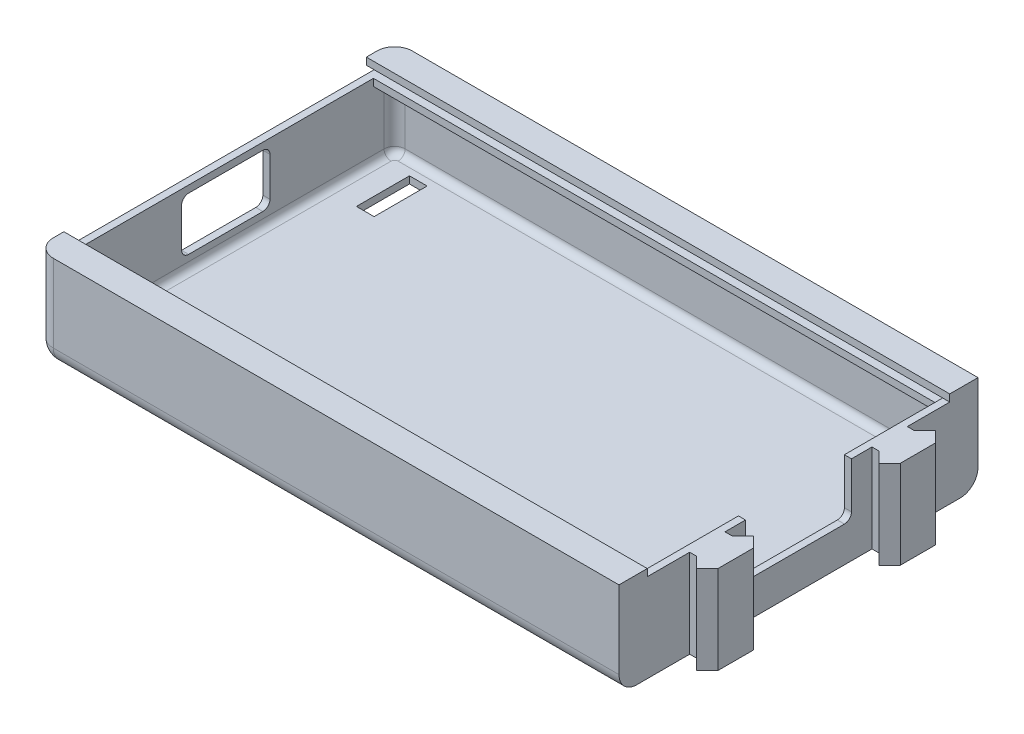
from build123d import *

# Parameters (mm, degrees)
SKETCH1_W           = 165.1
SKETCH1_H           = 101.6
BOSS_EXTRUDE1_DEPTH = 25
SHELL1_T            = -2
SKETCH2_W           = 5
SKETCH2_H           = 15
CUT_EXTRUDE1_DEPTH  = 25
CUT_EXTRUDE2_REACH  = 176.538
FILLET1_R           = 5
FILLET2_R           = 3
FILLET3_R           = 2
FILLET4_R           = 5
CUT_EXTRUDE3_REACH  = 176.538
SKETCH4_W           = 91.6
SKETCH4_H           = 4.4
BOSS_EXTRUDE4_START = -2.2
BOSS_EXTRUDE4_DEPTH = 2.2
BOSS_EXTRUDE2_START = 2
BOSS_EXTRUDE2_DEPTH = 2
LPATTERN1_COUNT     = 2
LPATTERN1_PITCH     = 4.2
BOSS_EXTRUDE3_DEPTH = 25
CUT_EXTRUDE4_REACH  = 182.513


with BuildPart() as part:
    # Sketch1 → Boss-Extrude1 (new body)
    with BuildSketch(Plane(origin=(0, 0, 0), x_dir=(1, 0, 0), z_dir=(0, 1, 0))):
        Rectangle(SKETCH1_W, SKETCH1_H)
    extrude(amount=BOSS_EXTRUDE1_DEPTH)

    # Shell1
    shell1_openings = [part.faces().sort_by_distance(p)[0] for p in [
        (0, 25, 0),
    ]]
    offset(amount=SHELL1_T, openings=shell1_openings, kind=Kind.INTERSECTION)

    # Sketch2 → Cut-Extrude1 (cut)
    with BuildSketch(Plane(origin=(0, 2, 0), x_dir=(1, 0, 0), z_dir=(0, 1, 0))):
        with Locations((-69.85, 37.3)):
            Rectangle(SKETCH2_W, SKETCH2_H)
    extrude(amount=-CUT_EXTRUDE1_DEPTH, mode=Mode.SUBTRACT)

    # Sketch3 → Cut-Extrude2 (cut, up to next)
    with BuildSketch(Plane(origin=(82.55, 0, 0), x_dir=(0, 0, -1), z_dir=(1, 0, 0)), mode=Mode.PRIVATE) as cut_extrude2_sk1:
        with BuildLine():
            Line((-15, 40), (15, 40))
            Line((15, 40), (15, 12))
            ThreePointArc((15, 12), (14.414213562, 10.585786438), (13, 10))
            Line((13, 10), (-13, 10))
            ThreePointArc((-13, 10), (-14.414213562, 10.585786438), (-15, 12))
            Line((-15, 12), (-15, 40))
        make_face()
    cut_extrude2_tool1 = extrude(cut_extrude2_sk1.sketch, amount=-CUT_EXTRUDE2_REACH, mode=Mode.PRIVATE) & part.part
    add(cut_extrude2_tool1.solids().sort_by_distance((82.55, 25.027814, 0))[0], mode=Mode.SUBTRACT)

    # Fillet1
    fillet1_edges = [part.edges().sort_by_distance(p)[0] for p in [
        (-82.55, 12.5, -50.8),
        (-82.55, 12.5, 50.8),
    ]]
    fillet(fillet1_edges, radius=FILLET1_R)

    # Fillet2
    fillet2_edges = [part.edges().sort_by_distance(p)[0] for p in [
        (-80.55, 13.5, -48.8),
        (-80.55, 13.5, 48.8),
        (80.55, 13.5, 48.8),
        (80.55, 13.5, -48.8),
    ]]
    fillet(fillet2_edges, radius=FILLET2_R)

    # Fillet3
    fillet3_edges = [part.edges().sort_by_distance(p)[0] for p in [
        (80.55, 2, 0),
        (-80.55, 2, 0),
        (0, 2, 48.8),
        (0, 2, -48.8),
        (-79.671320344, 2, -47.921320344),
        (-79.671320344, 2, 47.921320344),
        (79.671320344, 2, 47.921320344),
        (79.671320344, 2, -47.921320344),
    ]]
    fillet(fillet3_edges, radius=FILLET3_R)

    # Fillet4
    fillet4_edges = [part.edges().sort_by_distance(p)[0] for p in [
        (2.5, 0, -50.8),
        (2.5, 0, 50.8),
        (-82.55, 0, 0),
        (-81.085533906, 0, -49.335533906),
        (-81.085533906, 0, 49.335533906),
    ]]
    fillet(fillet4_edges, radius=FILLET4_R)

    # Sketch4 → Cut-Extrude3 (cut, up to next)
    with BuildSketch(Plane.ZY.offset(82.55), mode=Mode.PRIVATE) as cut_extrude3_sk1:
        with Locations((0, 25)):
            Rectangle(SKETCH4_W, SKETCH4_H)
    cut_extrude3_tool1 = extrude(cut_extrude3_sk1.sketch, amount=-CUT_EXTRUDE3_REACH, mode=Mode.PRIVATE) & part.part
    add(cut_extrude3_tool1.solids().sort_by_distance((-82.55, 25, 0))[0], mode=Mode.SUBTRACT)

    # Sketch8 → Boss-Extrude4 (add)
    with BuildSketch(Plane(origin=(0, 25, 0), x_dir=(1, 0, 0), z_dir=(0, 1, 0)).offset(BOSS_EXTRUDE4_START)):
        with BuildLine():
            Line((-77.55, -48.8), (77.55, -48.8))
            ThreePointArc((77.55, -48.8), (79.671320344, -47.921320344), (80.55, -45.8))
            Line((80.55, -45.8), (-80.55, -45.8))
            ThreePointArc((-80.55, -45.8), (-79.671320344, -47.921320344), (-77.55, -48.8))
        make_face()
        with BuildLine():
            Line((77.55, 48.8), (-77.55, 48.8))
            ThreePointArc((-77.55, 48.8), (-79.671320344, 47.921320344), (-80.55, 45.8))
            Line((-80.55, 45.8), (80.55, 45.8))
            ThreePointArc((80.55, 45.8), (79.671320344, 47.921320344), (77.55, 48.8))
        make_face()
    extrude(amount=BOSS_EXTRUDE4_DEPTH)

    # Sketch5 → Boss-Extrude2 (add)
    with BuildSketch(Plane(origin=(0, 25, 0), x_dir=(1, 0, 0), z_dir=(0, 1, 0)).offset(BOSS_EXTRUDE2_START)):
        with BuildLine():
            Line((-77.55, -50.8), (82.55, -50.8))
            Line((82.55, -50.8), (82.55, -42.8))
            Line((82.55, -42.8), (-82.55, -42.8))
            Line((-82.55, -42.8), (-82.55, -45.8))
            ThreePointArc((-82.55, -45.8), (-81.085533906, -49.335533906), (-77.55, -50.8))
        make_face()
        with BuildLine():
            Line((82.55, 50.8), (-77.55, 50.8))
            ThreePointArc((-77.55, 50.8), (-81.085533906, 49.335533906), (-82.55, 45.8))
            Line((-82.55, 45.8), (-82.55, 42.8))
            Line((-82.55, 42.8), (82.55, 42.8))
            Line((82.55, 42.8), (82.55, 50.8))
        make_face()
    boss_extrude2 = extrude(amount=-BOSS_EXTRUDE2_DEPTH)

    # LPattern1: Boss-Extrude2 ×2
    with Locations(*[(0, -i * LPATTERN1_PITCH, 0) for i in range(1, LPATTERN1_COUNT)]):
        add(boss_extrude2)

    # Sketch6 → Boss-Extrude3 (add)
    with BuildSketch(Plane.XZ):
        Polygon((82.55, -30.8), (84.55, -30.8), (87.55, -33.8), (90.55, -30.8), (90.55, -20.8), (87.55, -17.8), (84.55, -20.8), (82.55, -20.8), align=None)
        Polygon((82.55, 20.8), (82.55, 30.8), (84.55, 30.8), (87.55, 33.8), (90.55, 30.8), (90.55, 20.8), (87.55, 17.8), (84.55, 20.8), align=None)
    extrude(amount=-BOSS_EXTRUDE3_DEPTH)

    # Sketch7 → Cut-Extrude4 (cut, up to next)
    with BuildSketch(Plane(origin=(-80.55, 0, 0), x_dir=(0, 0, -1), z_dir=(1, 0, 0)), mode=Mode.PRIVATE) as cut_extrude4_sk1:
        with BuildLine():
            Line((11.519977141, 20.8), (-9.480022859, 20.8))
            ThreePointArc((-9.480022859, 20.8), (-10.894236421, 20.214213562), (-11.480022859, 18.8))
            Line((-11.480022859, 18.8), (-11.480022859, 7.8))
            ThreePointArc((-11.480022859, 7.8), (-10.894236421, 6.385786438), (-9.480022859, 5.8))
            Line((-9.480022859, 5.8), (11.519977141, 5.8))
            ThreePointArc((11.519977141, 5.8), (12.934190704, 6.385786438), (13.519977141, 7.8))
            Line((13.519977141, 7.8), (13.519977141, 18.8))
            ThreePointArc((13.519977141, 18.8), (12.934190704, 20.214213562), (11.519977141, 20.8))
        make_face()
    cut_extrude4_tool1 = extrude(cut_extrude4_sk1.sketch, amount=-CUT_EXTRUDE4_REACH, mode=Mode.PRIVATE) & part.part
    add(cut_extrude4_tool1.solids().sort_by_distance((-80.55, 13.3, -1.019977))[0], mode=Mode.SUBTRACT)


solid = part.part
